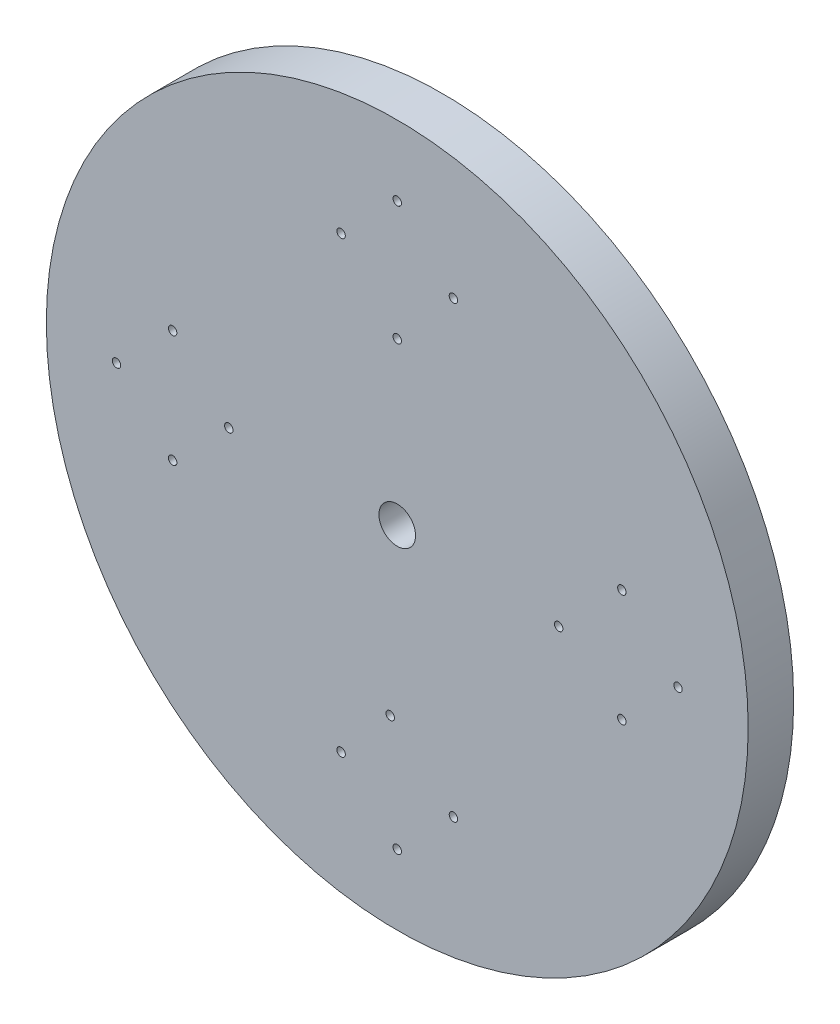
from build123d import *

# Parameters (mm, degrees)
SKETCH_1_R               = 125
EXTRUDE_1_DEPTH          = 8.1
CUT_EXTRUDE_1_DEPTH      = 178.517435763
CUT_EXTRUDE_1_DEPTH_BACK = 178.517435763
SKETCH_3_R               = 6.52
SKETCH_2_R               = 1.03
CUT_EXTRUDE_4_DEPTH      = 10
SKETCH_7_R               = 1.5
CUT_EXTRUDE_5_DEPTH      = 10


with BuildPart() as part:
    # 草图1 → 凸台-拉伸1 (new, symmetric)
    with BuildSketch(Plane.XY):
        Circle(SKETCH_1_R)
    extrude(amount=EXTRUDE_1_DEPTH, both=True)

    # 草图3 → 切除-拉伸1 (cut, two sides: drawn at the far end of the back side and taken through both)
    with BuildSketch(Plane.XY.offset(8.1).offset(-CUT_EXTRUDE_1_DEPTH_BACK)):
        Circle(SKETCH_3_R)
    extrude(amount=CUT_EXTRUDE_1_DEPTH + CUT_EXTRUDE_1_DEPTH_BACK, mode=Mode.SUBTRACT)

    # 草图2 → 切除-拉伸4 (cut)
    with BuildSketch(Plane(origin=(0, 0, -8.1), x_dir=(-1, 0, 0), z_dir=(0, 0, -1))):
        with Locations((0, 34.5)):
            Circle(SKETCH_2_R)
        with Locations((13.202578417, 31.873843872)):
            Circle(SKETCH_2_R)
        with Locations((24.395183951, 24.395183951)):
            Circle(SKETCH_2_R)
        with Locations((31.873843872, 13.202578417)):
            Circle(SKETCH_2_R)
        with Locations((34.5, 0)):
            Circle(SKETCH_2_R)
        with Locations((31.873843872, -13.202578417)):
            Circle(SKETCH_2_R)
        with Locations((24.395183951, -24.395183951)):
            Circle(SKETCH_2_R)
        with Locations((13.202578417, -31.873843872)):
            Circle(SKETCH_2_R)
        with Locations((0, -34.5)):
            Circle(SKETCH_2_R)
        with Locations((-13.202578417, -31.873843872)):
            Circle(SKETCH_2_R)
        with Locations((-24.395183951, -24.395183951)):
            Circle(SKETCH_2_R)
        with Locations((-31.873843872, -13.202578417)):
            Circle(SKETCH_2_R)
        with Locations((-34.5, 0)):
            Circle(SKETCH_2_R)
        with Locations((-31.873843872, 13.202578417)):
            Circle(SKETCH_2_R)
        with Locations((-24.395183951, 24.395183951)):
            Circle(SKETCH_2_R)
        with Locations((-13.202578417, 31.873843872)):
            Circle(SKETCH_2_R)
    extrude(amount=-CUT_EXTRUDE_4_DEPTH, mode=Mode.SUBTRACT)

    # 草图7 → 切除-拉伸5 (cut)
    with BuildSketch(Plane.XY.offset(8.1)):
        with Locations((-100, 0)):
            Circle(SKETCH_7_R)
        with Locations((-80, 20)):
            Circle(SKETCH_7_R)
        with Locations((-60, 0)):
            Circle(SKETCH_7_R)
        with Locations((-80, -20)):
            Circle(SKETCH_7_R)
        with Locations((0, 57.5)):
            Circle(SKETCH_7_R)
        with Locations((57.5, -2.5)):
            Circle(SKETCH_7_R)
        with Locations((-2.5, -60)):
            Circle(SKETCH_7_R)
        with Locations((-20, 80)):
            Circle(SKETCH_7_R)
        with Locations((80, 20)):
            Circle(SKETCH_7_R)
        with Locations((20, -80)):
            Circle(SKETCH_7_R)
        with Locations((20, 80)):
            Circle(SKETCH_7_R)
        with Locations((0, 100)):
            Circle(SKETCH_7_R)
        with Locations((80, -20)):
            Circle(SKETCH_7_R)
        with Locations((100, 0)):
            Circle(SKETCH_7_R)
        with Locations((-20, -80)):
            Circle(SKETCH_7_R)
        with Locations((0, -100)):
            Circle(SKETCH_7_R)
    extrude(amount=-CUT_EXTRUDE_5_DEPTH, mode=Mode.SUBTRACT)


solid = part.part
